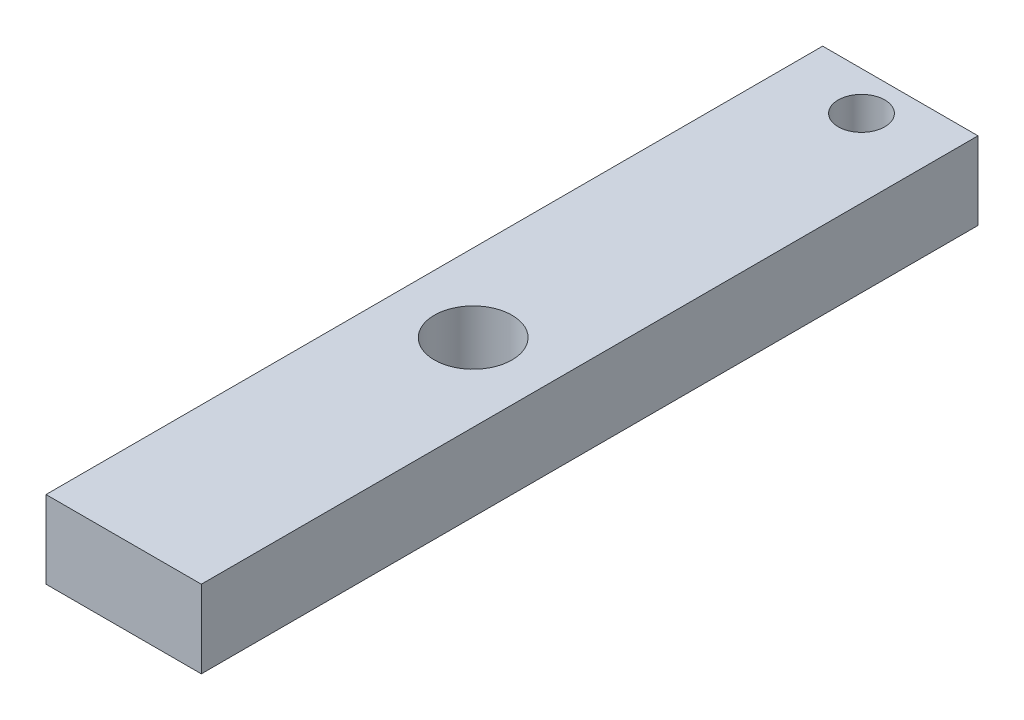
from build123d import *

# Parameters (mm, degrees)
SKETCH1_W           = 20
SKETCH1_H           = 100
SKETCH1_R           = 3
SKETCH1_R_2         = 5
BOSS_EXTRUDE1_DEPTH = 10


with BuildPart() as part:
    # Sketch1 → Boss-Extrude1 (new body)
    with BuildSketch(Plane(origin=(0, 0, 0), x_dir=(1, 0, 0), z_dir=(0, 1, 0))):
        Rectangle(SKETCH1_W, SKETCH1_H)
        with Locations(Location((0, 45, 0), (0, 0, 270))):
            Circle(SKETCH1_R, mode=Mode.SUBTRACT)
        with Locations(Location((0, -5, 0), (0, 0, 270))):
            Circle(SKETCH1_R_2, mode=Mode.SUBTRACT)
    extrude(amount=BOSS_EXTRUDE1_DEPTH)


solid = part.part
